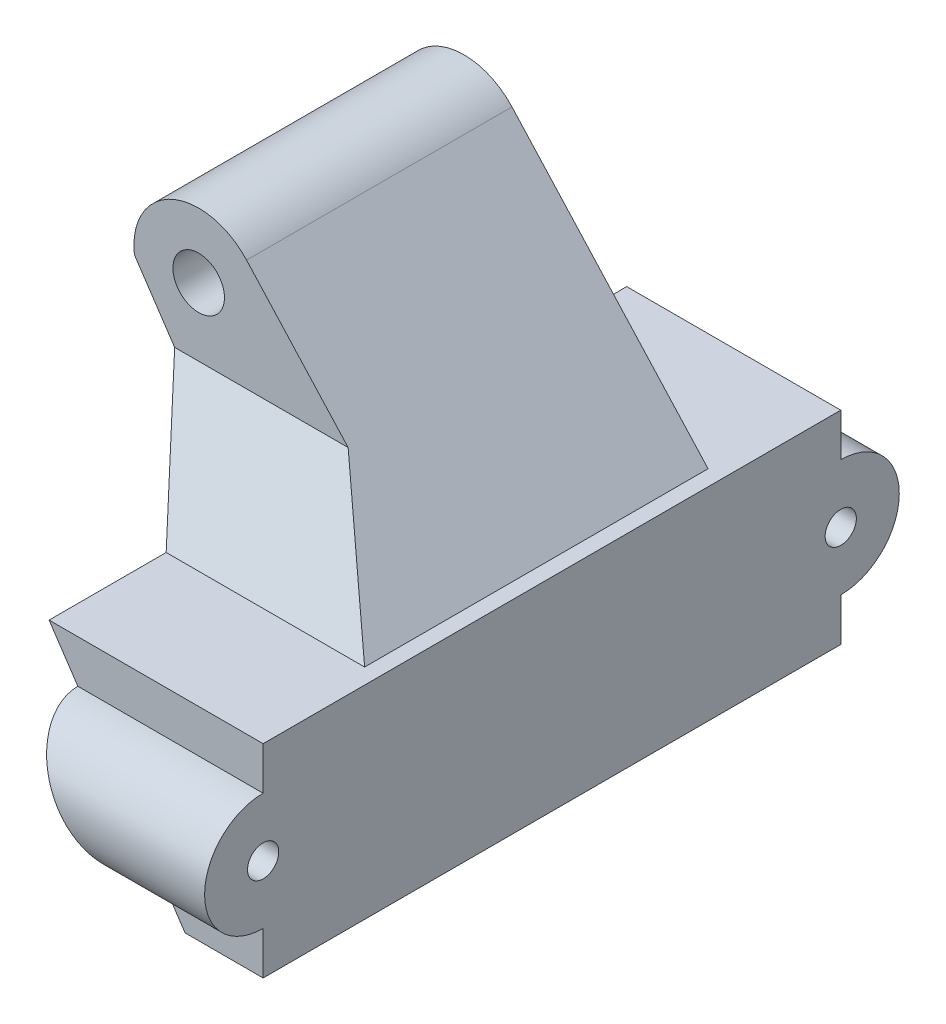
from build123d import *

# Parameters (mm, degrees)
ESQUISSE1_R             = 1.65
BOSS_EXTRU_1_DEPTH      = 11
BOSS_EXTRU_2_REACH      = 66.162
ESQUISSE2_R             = 1
ENL_V_MAT_EXTRU_1_DEPTH = 30


with BuildPart() as part:
    # Esquisse1 → Boss.-Extru.1 (new, symmetric)
    with BuildSketch(Plane.XY):
        with BuildLine():
            Line((11.628725406, -24), (16.628725406, -24))
            Line((16.628725406, -24), (16.628725406, -11))
            Line((16.628725406, -11), (15.628725406, -11))
            Line((15.628725406, -11), (3.068517607, 2.794047189))
            ThreePointArc((3.068517607, 2.794047189), (-1.728115101, 3.77307808), (-4.119967472, -0.49836536))
            Line((-4.119967472, -0.49836536), (11.628725406, -24))
        make_face()
        Circle(ESQUISSE1_R, mode=Mode.SUBTRACT)
    extrude(amount=BOSS_EXTRU_1_DEPTH, both=True)

    # Boss.-Extru.2: up to this plane
    boss_extru_2_end = Plane(origin=(-4.119967472, -0.49836536, 11), z_dir=(0.8307275154862657, 0.5566792568562408, 0))
    # Esquisse2 → Boss.-Extru.2 (add, up to the surface)
    with BuildSketch(Plane(origin=(16.628725406, 0, 0), x_dir=(0, 0, -1), z_dir=(1, 0, 0)), mode=Mode.PRIVATE) as boss_extru_2_sk1:
        with BuildLine():
            ThreePointArc((-18.5, -13.75), (-22.25, -17.5), (-18.5, -21.25))
            Line((-18.5, -21.25), (-18.5, -24))
            Line((-18.5, -24), (18.5, -24))
            Line((18.5, -24), (18.5, -21.25))
            ThreePointArc((18.5, -21.25), (22.25, -17.5), (18.5, -13.75))
            Line((18.5, -13.75), (18.5, -11))
            Line((18.5, -11), (-18.5, -11))
            Line((-18.5, -11), (-18.5, -13.75))
        make_face()
        with Locations((-18.5, -17.5)):
            Circle(ESQUISSE2_R, mode=Mode.SUBTRACT)
        with Locations((18.5, -17.5)):
            Circle(ESQUISSE2_R, mode=Mode.SUBTRACT)
    boss_extru_2_tool1 = split(extrude(boss_extru_2_sk1.sketch, amount=-BOSS_EXTRU_2_REACH, mode=Mode.PRIVATE), bisect_by=boss_extru_2_end, keep=Keep.BOTH, mode=Mode.PRIVATE)
    add(boss_extru_2_tool1.solids().sort_by_distance((16.628725, -17.5, 0))[0])

    # Esquisse3 → Enlèv. mat.-Extru.1 (cut)
    with BuildSketch(Plane(origin=(16.628725406, 0, 0), x_dir=(0, 0, -1), z_dir=(1, 0, 0))):
        Polygon((-6, 4.15), (-6, -4.35), (-11, -11), (-11, 4.15), align=None)
    extrude(amount=-ENL_V_MAT_EXTRU_1_DEPTH, mode=Mode.SUBTRACT)


solid = part.part
